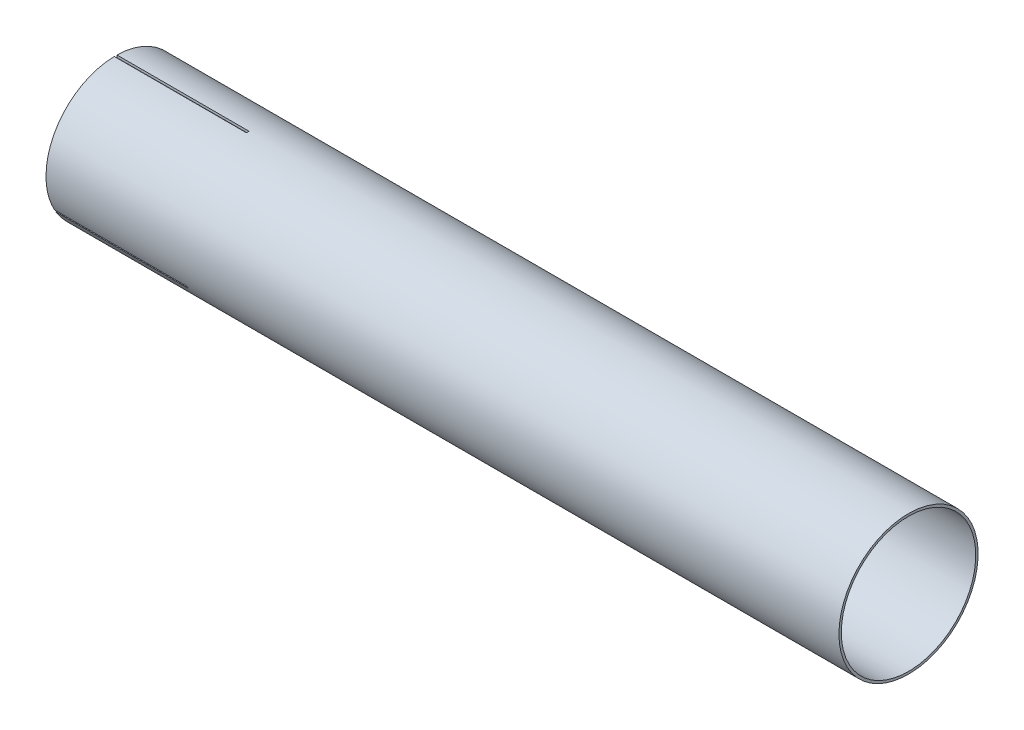
from build123d import *

# Parameters (mm, degrees)
ESQUISSE1_W                  = 900
ESQUISSE1_H                  = 2.71
ESQUISSE2_W                  = 150
ESQUISSE2_H                  = 3
ENL_V_MAT_EXTRU_1_DEPTH      = 907.907933585
R_P_TITION_CIRCULAIRE1_COUNT = 3
R_P_TITION_CIRCULAIRE1_ANGLE = 240


with BuildPart() as part:
    # Esquisse1 → Révolution1 (revolve)
    with BuildSketch(Plane.XY, mode=Mode.PRIVATE) as r_volution1_sk:
        with Locations((450, 77.645)):
            Rectangle(ESQUISSE1_W, ESQUISSE1_H)
    revolve(r_volution1_sk.sketch.rotate(Axis((0, 0, 0), (1, 0, 0)), 90), axis=Axis((0, 0, 0), (1, 0, 0)))

    # Esquisse2 → Enlèv. mat.-Extru.1 (cut, through all)
    with BuildSketch(Plane(origin=(0, 0, 0), x_dir=(1, 0, 0), z_dir=(0, 1, 0))):
        with Locations((75, 0)):
            Rectangle(ESQUISSE2_W, ESQUISSE2_H)
    enl_v_mat_extru_1 = extrude(amount=ENL_V_MAT_EXTRU_1_DEPTH, mode=Mode.SUBTRACT)

    # Répétition circulaire1: Enlèv. mat.-Extru.1 ×3 about axis
    r_p_tition_circulaire1_axis = Axis((0, 0, 0), (-1, 0, 0))
    for i in range(1, R_P_TITION_CIRCULAIRE1_COUNT):
        add(enl_v_mat_extru_1.rotate(r_p_tition_circulaire1_axis, i * R_P_TITION_CIRCULAIRE1_ANGLE / (R_P_TITION_CIRCULAIRE1_COUNT - 1)), mode=Mode.SUBTRACT)


solid = part.part
